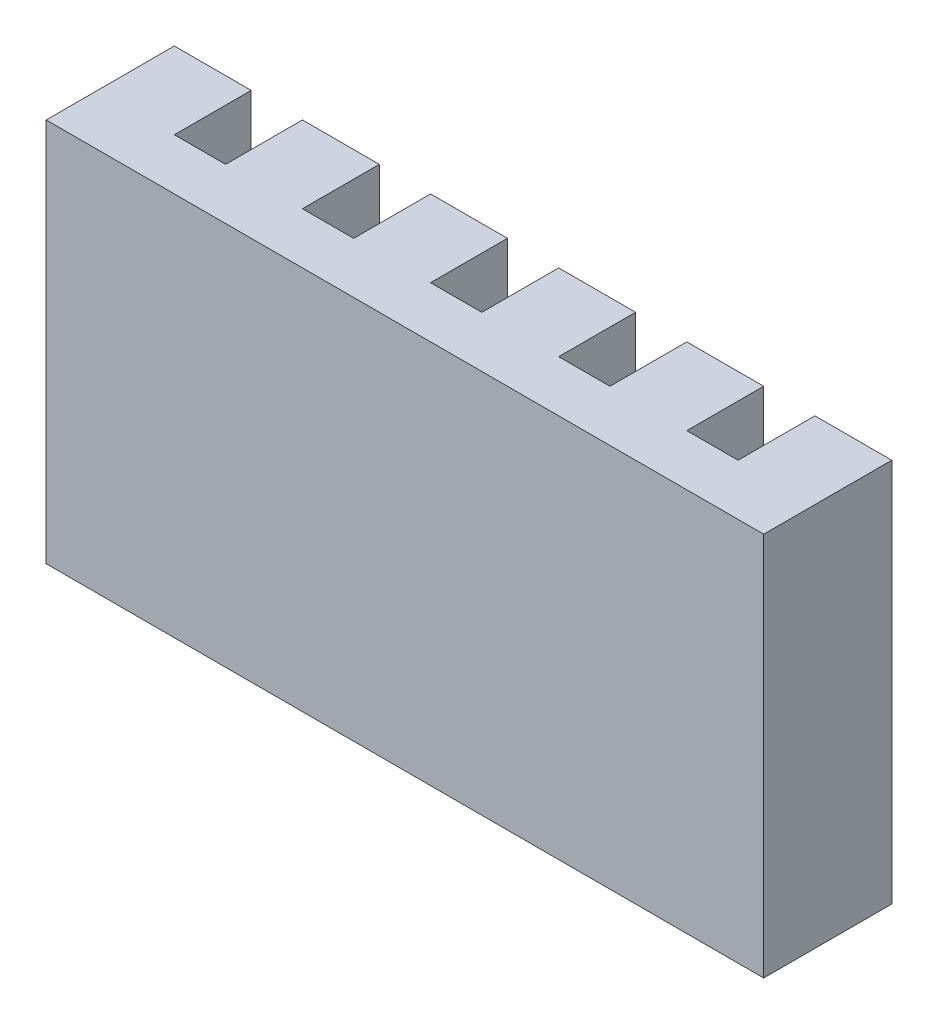
from build123d import *

# Parameters (mm, degrees)
BOSS_EXTRUDE4_DEPTH = 7.5


with BuildPart() as part:
    # Sketch3 → Boss-Extrude4 (new, symmetric)
    with BuildSketch(Plane(origin=(0, 0, 0), x_dir=(1, 0, 0), z_dir=(0, 1, 0))):
        Polygon((-14, 0), (14, 0), (14, 5), (11, 5), (11, 2), (9, 2), (9, 5), (6, 5), (6, 2), (4, 2), (4, 5), (1, 5), (1, 2), (-1, 2), (-1, 5), (-4, 5), (-4, 2), (-6, 2), (-6, 5), (-9, 5), (-9, 2), (-11, 2), (-11, 5), (-14, 5), align=None)
    extrude(amount=BOSS_EXTRUDE4_DEPTH, both=True)


solid = part.part
